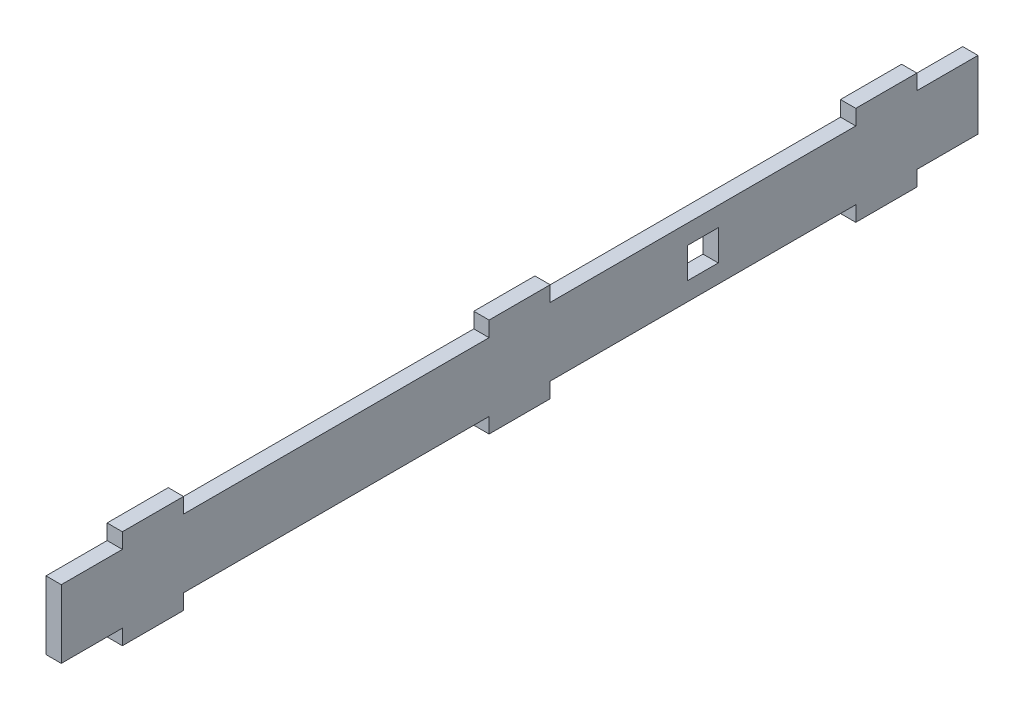
from build123d import *

# Parameters (mm, degrees)
SKETCH1_W           = 300
SKETCH1_H           = 22.32
BOSS_EXTRUDE1_DEPTH = 5
SKETCH2_W           = 5
SKETCH2_H           = 20
BOSS_EXTRUDE2_DEPTH = 5
SKETCH3_W           = 5
SKETCH3_H           = 20
BOSS_EXTRUDE3_DEPTH = 5
SKETCH4_W           = 10
SKETCH4_H           = 10
CUT_EXTRUDE1_DEPTH  = 5


with BuildPart() as part:
    # Sketch1 → Boss-Extrude1 (new body)
    with BuildSketch(Plane(origin=(0, 0, 0), x_dir=(0, 0, -1), z_dir=(1, 0, 0))):
        with Locations((150, 11.16)):
            Rectangle(SKETCH1_W, SKETCH1_H)
    extrude(amount=BOSS_EXTRUDE1_DEPTH)

    # Sketch2 → Boss-Extrude2 (add)
    with BuildSketch(Plane(origin=(0, 22.32, 0), x_dir=(1, 0, 0), z_dir=(0, 1, 0))):
        with Locations((2.5, 30)):
            Rectangle(SKETCH2_W, SKETCH2_H)
        with Locations((2.5, 270)):
            Rectangle(SKETCH2_W, SKETCH2_H)
        with Locations((2.5, 150)):
            Rectangle(SKETCH2_W, SKETCH2_H)
    extrude(amount=BOSS_EXTRUDE2_DEPTH)

    # Sketch3 → Boss-Extrude3 (add)
    with BuildSketch(Plane.XZ):
        with Locations((2.5, -30)):
            Rectangle(SKETCH3_W, SKETCH3_H)
        with Locations((2.5, -150)):
            Rectangle(SKETCH3_W, SKETCH3_H)
        with Locations((2.5, -270)):
            Rectangle(SKETCH3_W, SKETCH3_H)
    extrude(amount=BOSS_EXTRUDE3_DEPTH)

    # Sketch4 → Cut-Extrude1 (cut)
    with BuildSketch(Plane(origin=(5, 0, 0), x_dir=(0, 0, -1), z_dir=(1, 0, 0))):
        with Locations((210, 11)):
            Rectangle(SKETCH4_W, SKETCH4_H)
    extrude(amount=-CUT_EXTRUDE1_DEPTH, mode=Mode.SUBTRACT)


solid = part.part
